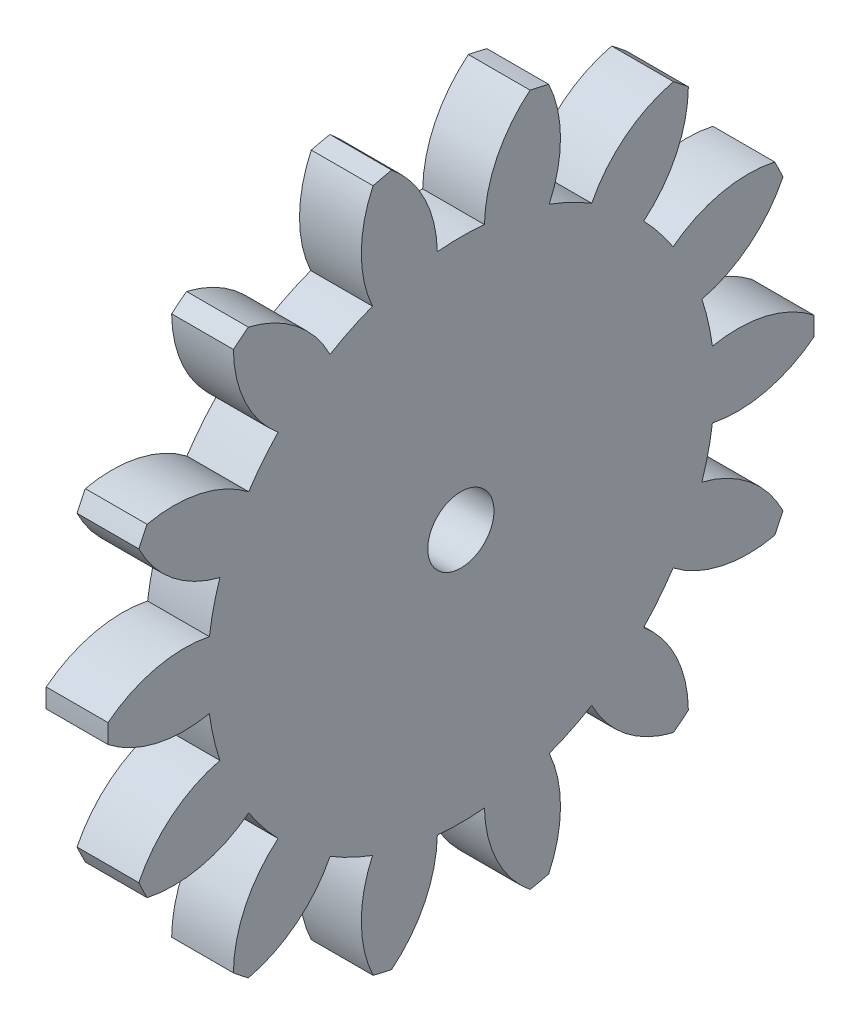
from build123d import *

# Parameters (mm, degrees)
BASPROSKE_W     = 2.8
BASPROSKE_H     = 16
TOOTHCUT_DEPTH  = 23.8
TEETHCUTS_COUNT = 14
TEETHCUTS_ANGLE = 334.285714286
BORSKE_R        = 1.5
BORE_DEPTH      = 50.0000508


with BuildPart() as part:
    # BasProSke → Base-Revolve (revolve)
    with BuildSketch(Plane(origin=(0, 0, 0), x_dir=(1, 0, 0), z_dir=(0, 1, 0)), mode=Mode.PRIVATE) as base_revolve_sk:
        with Locations((1.4, 8)):
            Rectangle(BASPROSKE_W, BASPROSKE_H)
    revolve(base_revolve_sk.sketch.rotate(Axis((-10, 0, 0), (1, 0, 0)), 180), axis=Axis((-10, 0, 0), (1, 0, 0)))

    # TooCutSke → ToothCut (cut, through all)
    with BuildSketch(Plane(origin=(0, 0, 0), x_dir=(0, 0, -1), z_dir=(1, 0, 0))):
        with BuildLine():
            ThreePointArc((1.067858192, 11.449309144), (0, 11.499), (-1.067858192, 11.449309144))
            ThreePointArc((-1.067858192, 11.449309144), (-1.641684211, 13.812780716), (-3.163375005, 15.710076503))
            ThreePointArc((-3.163375005, 15.710076503), (0, 16.0254), (3.163375005, 15.710076503))
            ThreePointArc((3.163375005, 15.710076503), (1.641684211, 13.812780716), (1.067858192, 11.449309144))
        make_face()
    toothcut = extrude(amount=TOOTHCUT_DEPTH, mode=Mode.SUBTRACT)

    # TeethCuts: ToothCut ×14 about axis
    teethcuts_axis = Axis((-10, 0, 0), (1, 0, 0))
    for i in range(1, TEETHCUTS_COUNT):
        add(toothcut.rotate(teethcuts_axis, i * TEETHCUTS_ANGLE / (TEETHCUTS_COUNT - 1)), mode=Mode.SUBTRACT)

    # BorSke → Bore (cut, symmetric)
    with BuildSketch(Plane(origin=(0, 0, 0), x_dir=(0, 0, -1), z_dir=(1, 0, 0))):
        with Locations(Location((0, 0, 0), (0, 0, 180))):
            Circle(BORSKE_R)
    extrude(amount=BORE_DEPTH, both=True, mode=Mode.SUBTRACT)


solid = part.part
